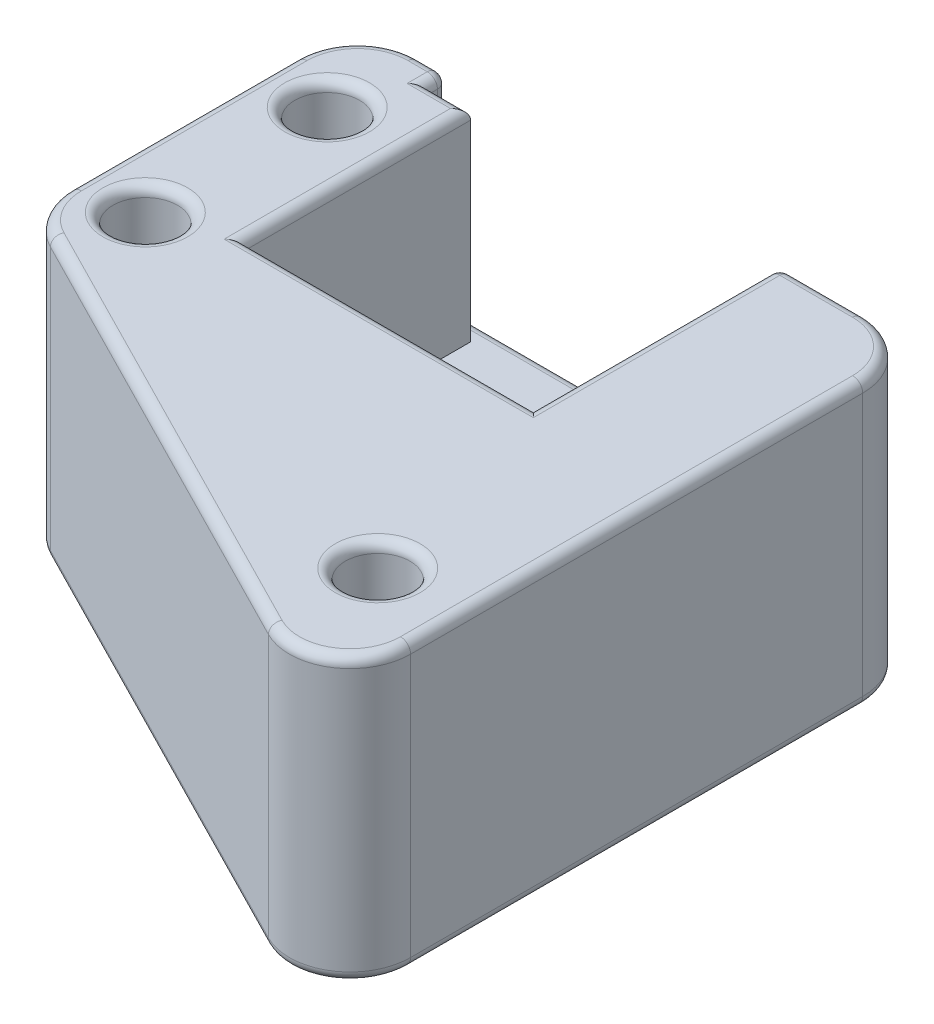
from build123d import *

# Parameters (mm, degrees)
SKETCH1_W           = 28
SKETCH1_H           = 16
SKETCH1_R           = 0.85
SKETCH1_R_2         = 1.6
BOSS_EXTRUDE1_DEPTH = 4
SKETCH2_R           = 1.6
BOSS_EXTRUDE2_DEPTH = 10
SKETCH4_R           = 1.6
BOSS_EXTRUDE3_DEPTH = 14
FILLET2_R           = 3
FILLET1_R           = 0.5


with BuildPart() as part:
    # Sketch1 → Boss-Extrude1 (new body)
    with BuildSketch(Plane(origin=(0, 0, 0), x_dir=(1, 0, 0), z_dir=(0, 1, 0))):
        with Locations((0, -2)):
            Rectangle(SKETCH1_W, SKETCH1_H)
        with Locations(Location((3.25, 0, 0), (0, 0, 270))):
            Circle(SKETCH1_R, mode=Mode.SUBTRACT)
        with Locations(Location((-3.25, 0, 0), (0, 0, 270))):
            Circle(SKETCH1_R, mode=Mode.SUBTRACT)
        with Locations(Location((-11, -7.5, 0), (0, 0, 270))):
            Circle(SKETCH1_R_2, mode=Mode.SUBTRACT)
        with Locations(Location((-11, 1.5, 0), (0, 0, 270))):
            Circle(SKETCH1_R_2, mode=Mode.SUBTRACT)
    extrude(amount=BOSS_EXTRUDE1_DEPTH)

    # Sketch2 → Boss-Extrude2 (add)
    with BuildSketch(Plane(origin=(0, 4, 0), x_dir=(1, 0, 0), z_dir=(0, 1, 0))):
        Polygon((-9.546214808, 6), (-9.546214808, 5), (-7.4, 5), (-7.4, -6.2), (6.9, -6.2), (6.9, 6), (14, 6), (14, -10), (-14, -10), (-14, 6), align=None)
        with Locations(Location((-11, -7.5, 0), (0, 0, 270))):
            Circle(SKETCH2_R, mode=Mode.SUBTRACT)
        with Locations(Location((-11, 1.5, 0), (0, 0, 270))):
            Circle(SKETCH2_R, mode=Mode.SUBTRACT)
    extrude(amount=BOSS_EXTRUDE2_DEPTH)

    # Sketch4 → Boss-Extrude3 (add, through all)
    with BuildSketch(Plane.XZ):
        Polygon((14, 10), (14, 24.266712586), (-14, 10), align=None)
        with Locations(Location((10, 17, 0), (0, 0, 270))):
            Circle(SKETCH4_R, mode=Mode.SUBTRACT)
    extrude(amount=-BOSS_EXTRUDE3_DEPTH)

    # Fillet2
    fillet2_edges = [part.edges().sort_by_distance(p)[0] for p in [
        (14, 7, 24.266712586),
        (-14, 7, 10),
        (-14, 7, -6),
        (14, 7, -6),
    ]]
    fillet(fillet2_edges, radius=FILLET2_R)

    # Fillet1
    fillet1_edges = [part.edges().sort_by_distance(p)[0] for p in [
        (3.25, 0, -0.85),
        (-3.25, 0, -0.85),
        (-11, 0, 5.9),
        (-11, 0, -3.1),
        (-1.323107404, 4, -6),
        (-10.273107404, 14, -6),
        (6.9, 14, 0.1),
        (-0.25, 14, 6.2),
        (-7.4, 14, 0.6),
        (-8.473107404, 14, -5),
        (-9.546214808, 14, -5.5),
        (-9.546214808, 9, -6),
        (6.9, 9, -6),
        (-11, 14, 5.9),
        (-11, 14, -3.1),
        (10, 14, 18.6),
        (10, 0, 18.6),
        (-14, 0, 2.580798818),
        (-14, 14, 2.580798818),
        (14, 0, 8.185578762),
        (-1.361971499, 0, 16.439397153),
        (0, 0, -6),
        (12.567495694, 0, 21.929078018),
        (-13.557920493, 0, 9.72909333),
        (13.121320344, 0, -5.121320344),
        (-13.121320344, 0, -5.121320344),
        (8.95, 14, -6),
        (-1.361971499, 14, 16.439397153),
        (14, 14, 8.185578762),
        (12.567495694, 14, 21.929078018),
        (-13.557920493, 14, 9.72909333),
        (13.121320344, 14, -5.121320344),
        (-13.121320344, 14, -5.121320344),
    ]]
    fillet(fillet1_edges, radius=FILLET1_R)


solid = part.part
